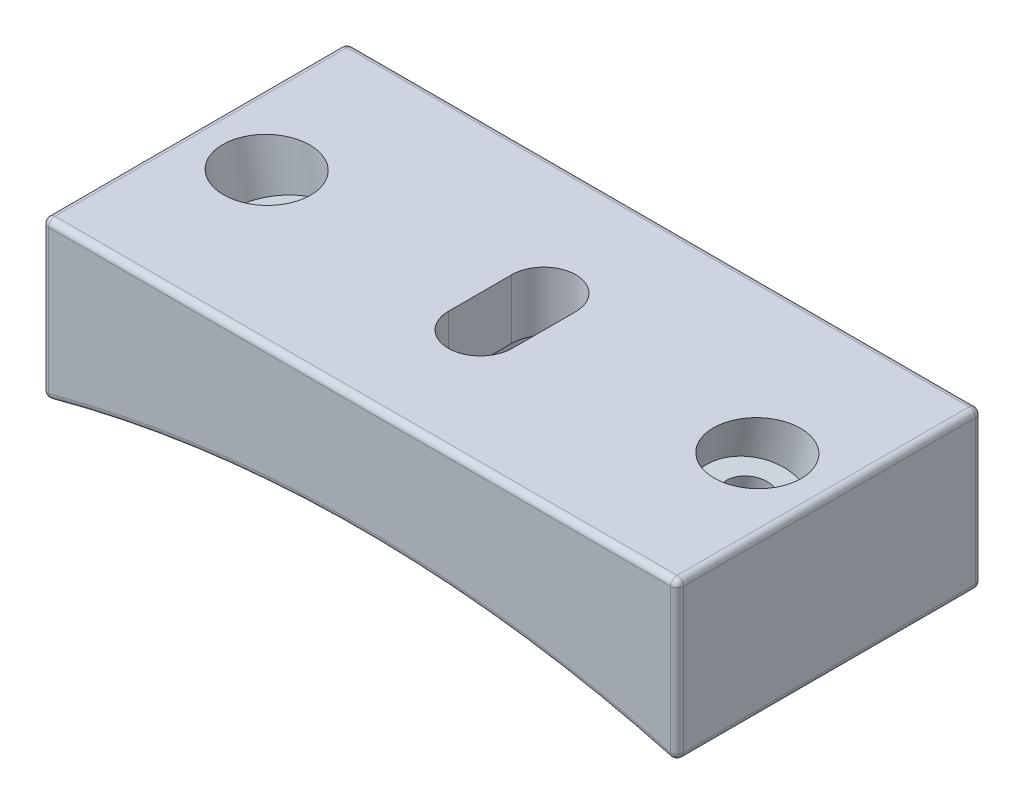
from build123d import *

# Parameters (mm, degrees)
BOSS_EXTRUDE1_DEPTH     = 30.48
FILLET1_R               = 0.635
CUT_EXTRUDE1_DEPTH      = 47.721039644
CUT_EXTRUDE6_DEPTH      = 46.498222745
CUT_EXTRUDE6_DEPTH_BACK = 5.588


with BuildPart() as part:
    # Sketch1 → Boss-Extrude1 (new body)
    with BuildSketch(Plane.XY):
        with BuildLine():
            Line((-31.75, 12.7), (31.75, 12.7))
            Line((31.75, 12.7), (31.75, -3.175))
            ThreePointArc((31.75, -3.175), (0, 1.167638116), (-31.75, -3.175))
            Line((-31.75, -3.175), (-31.75, 12.7))
        make_face()
    extrude(amount=BOSS_EXTRUDE1_DEPTH)

    # Sketch5 → Cut-Revolve1 (revolve, cut)
    with BuildSketch(Plane(origin=(0, 0, 15.24), x_dir=(-1, 0, 0), z_dir=(0, 0, -1)), mode=Mode.PRIVATE) as cut_revolve1_sk:
        Polygon((-21.850998632, -1.526179191), (-24.097184469, -1.950967591), (-25.975050427, 7.978766654), (-27.97166006, 7.601176966), (-29.631988117, 16.380619557), (-25.389192647, 17.182997645), align=None)
    cut_revolve1 = revolve(cut_revolve1_sk.sketch.rotate(Axis((25.728949918, 18.979557936, 15.24), (-0.1858216970998926, -0.9825834808742288, 0)), 180), axis=Axis((25.728949918, 18.979557936, 15.24), (-0.1858216970998926, -0.9825834808742288, 0)), mode=Mode.SUBTRACT)

    # Mirror1: Cut-Revolve1 across plane
    add(cut_revolve1.mirror(Plane(origin=(0, 0, 0), x_dir=(0, 0, 1), z_dir=(1, 0, 0))), mode=Mode.SUBTRACT)

    # Fillet1
    fillet1_edges = [part.edges().sort_by_distance(p)[0] for p in [
        (0, 12.7, 30.48),
        (-31.75, 4.7625, 30.48),
        (0, 1.167638116, 30.48),
        (-31.75, 4.7625, 0),
        (0, 12.7, 0),
        (31.75, 4.7625, 0),
        (0, 1.167638116, 0),
        (31.75, 4.7625, 30.48),
        (-31.75, -3.175, 15.24),
        (-31.75, 12.7, 15.24),
        (31.75, 12.7, 15.24),
        (31.75, -3.175, 15.24),
    ]]
    fillet(fillet1_edges, radius=FILLET1_R)

    # Sketch17 → Cut-Extrude1 (cut, through all)
    with BuildSketch(Plane(origin=(0, 12.7, 0), x_dir=(1, 0, 0), z_dir=(0, 1, 0))):
        with BuildLine():
            Line((-3.2004, -18.415), (-3.2004, -12.065))
            ThreePointArc((-3.2004, -12.065), (0, -8.8646), (3.2004, -12.065))
            Line((3.2004, -12.065), (3.2004, -18.415))
            ThreePointArc((3.2004, -18.415), (0, -21.6154), (-3.2004, -18.415))
        make_face()
    extrude(amount=-CUT_EXTRUDE1_DEPTH, mode=Mode.SUBTRACT)

    # Sketch18 → Cut-Extrude6 (cut, two sides: drawn at the far end of the back side and taken through both)
    with BuildSketch(Plane(origin=(0, 1.167638116, 0), x_dir=(-1, 0, 0), z_dir=(0, -1, 0)).offset(-CUT_EXTRUDE6_DEPTH_BACK)):
        with BuildLine():
            Line((8.382, -12.065), (8.382, -18.415))
            ThreePointArc((8.382, -18.415), (0, -26.797), (-8.382, -18.415))
            Line((-8.382, -18.415), (-8.382, -12.065))
            ThreePointArc((-8.382, -12.065), (0, -3.683), (8.382, -12.065))
        make_face()
    extrude(amount=CUT_EXTRUDE6_DEPTH + CUT_EXTRUDE6_DEPTH_BACK, mode=Mode.SUBTRACT)


solid = part.part
